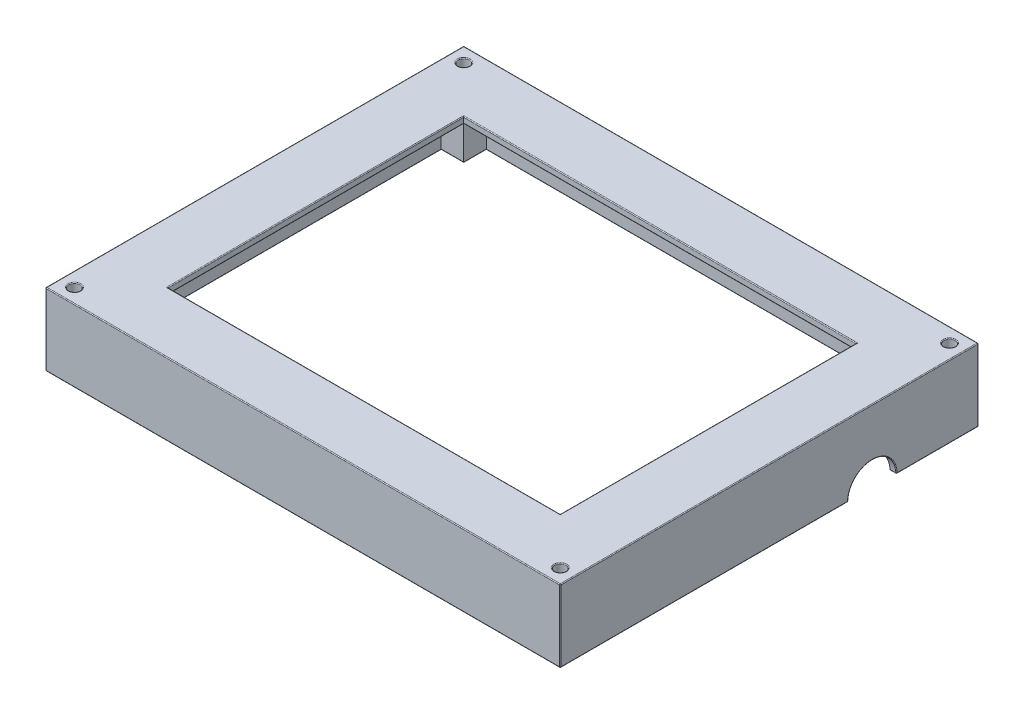
from build123d import *

# Parameters (mm, degrees)
SKETCH1_W           = 160
SKETCH1_H           = 130
SKETCH1_W_2         = 122
SKETCH1_H_2         = 92
BOSS_EXTRUDE1_DEPTH = 2
SKETCH1_3_W         = 2
SKETCH1_3_H         = 112
SKETCH1_3_W_2       = 142
SKETCH1_3_H_2       = 2
BOSS_EXTRUDE3_DEPTH = 22.5
SKETCH1_5_R         = 1.75
BOSS_EXTRUDE5_DEPTH = 14.5
SKETCH3_R           = 7.5
CUT_EXTRUDE1_DEPTH  = 4.5
FILLET1_R           = 0.25


with BuildPart() as part:
    # Sketch1 → Boss-Extrude1 (new body)
    with BuildSketch(Plane(origin=(0, 0, 0), x_dir=(1, 0, 0), z_dir=(0, 1, 0))):
        with Locations((80, 65)):
            Rectangle(SKETCH1_W, SKETCH1_H)
        with Locations((80, 65)):
            Rectangle(SKETCH1_W_2, SKETCH1_H_2, mode=Mode.SUBTRACT)
        Polygon((7.125, 123.984455543), (7.125, 127.015544457), (4.5, 128.531088913), (1.875, 127.015544457), (1.875, 123.984455543), (4.5, 122.468911087), align=None, mode=Mode.SUBTRACT)
        Polygon((158.125, 123.984455543), (158.125, 127.015544457), (155.5, 128.531088913), (152.875, 127.015544457), (152.875, 123.984455543), (155.5, 122.468911087), align=None, mode=Mode.SUBTRACT)
        Polygon((158.125, 2.984455543), (158.125, 6.015544457), (155.5, 7.531088913), (152.875, 6.015544457), (152.875, 2.984455543), (155.5, 1.468911087), align=None, mode=Mode.SUBTRACT)
        Polygon((7.125, 2.984455543), (7.125, 6.015544457), (4.5, 7.531088913), (1.875, 6.015544457), (1.875, 2.984455543), (4.5, 1.468911087), align=None, mode=Mode.SUBTRACT)
    extrude(amount=-BOSS_EXTRUDE1_DEPTH)

    # Sketch1<3> → Boss-Extrude3 (add)
    # profile 1 of 8: a face of its own
    with BuildSketch(Plane(origin=(0, 0, 0), x_dir=(1, 0, 0), z_dir=(0, 1, 0))):
        with Locations((159, 65)):
            Rectangle(SKETCH1_3_W, SKETCH1_3_H)
    # profile 2 of 8: a face of its own
    with BuildSketch(Plane(origin=(0, 0, 0), x_dir=(1, 0, 0), z_dir=(0, 1, 0))):
        Polygon((160, 130), (151, 130), (151, 128), (151, 121), (158, 121), (160, 121), align=None)
        Polygon((158.125, 127.015544457), (158.125, 123.984455543), (155.5, 122.468911087), (152.875, 123.984455543), (152.875, 127.015544457), (155.5, 128.531088913), align=None, mode=Mode.SUBTRACT)
    # profile 3 of 8: a face of its own
    with BuildSketch(Plane(origin=(0, 0, 0), x_dir=(1, 0, 0), z_dir=(0, 1, 0))):
        with Locations((80, 129)):
            Rectangle(SKETCH1_3_W_2, SKETCH1_3_H_2)
    # profile 4 of 8: a face of its own
    with BuildSketch(Plane(origin=(0, 0, 0), x_dir=(1, 0, 0), z_dir=(0, 1, 0))):
        Polygon((0, 130), (0, 121), (2, 121), (9, 121), (9, 128), (9, 130), align=None)
        Polygon((7.125, 127.015544457), (7.125, 123.984455543), (4.5, 122.468911087), (1.875, 123.984455543), (1.875, 127.015544457), (4.5, 128.531088913), align=None, mode=Mode.SUBTRACT)
    # profile 5 of 8: a face of its own
    with BuildSketch(Plane(origin=(0, 0, 0), x_dir=(1, 0, 0), z_dir=(0, 1, 0))):
        with Locations((1, 65)):
            Rectangle(SKETCH1_3_W, SKETCH1_3_H)
    # profile 6 of 8: a face of its own
    with BuildSketch(Plane(origin=(0, 0, 0), x_dir=(1, 0, 0), z_dir=(0, 1, 0))):
        Polygon((151, 2), (151, 0), (160, 0), (160, 9), (158, 9), (151, 9), align=None)
        Polygon((158.125, 6.015544457), (158.125, 2.984455543), (155.5, 1.468911087), (152.875, 2.984455543), (152.875, 6.015544457), (155.5, 7.531088913), align=None, mode=Mode.SUBTRACT)
    # profile 7 of 8: a face of its own
    with BuildSketch(Plane(origin=(0, 0, 0), x_dir=(1, 0, 0), z_dir=(0, 1, 0))):
        with Locations((80, 1)):
            Rectangle(SKETCH1_3_W_2, SKETCH1_3_H_2)
    # profile 8 of 8: a face of its own
    with BuildSketch(Plane(origin=(0, 0, 0), x_dir=(1, 0, 0), z_dir=(0, 1, 0))):
        Polygon((2, 9), (0, 9), (0, 0), (9, 0), (9, 2), (9, 9), align=None)
        Polygon((7.125, 6.015544457), (7.125, 2.984455543), (4.5, 1.468911087), (1.875, 2.984455543), (1.875, 6.015544457), (4.5, 7.531088913), align=None, mode=Mode.SUBTRACT)
    extrude(amount=-BOSS_EXTRUDE3_DEPTH)

    # Sketch1<5> → Boss-Extrude5 (add)
    # profile 1 of 4: a face of its own
    with BuildSketch(Plane(origin=(0, 0, 0), x_dir=(1, 0, 0), z_dir=(0, 1, 0))):
        Polygon((1.875, 123.984455543), (4.5, 122.468911087), (7.125, 123.984455543), (7.125, 127.015544457), (4.5, 128.531088913), (1.875, 127.015544457), align=None)
        with Locations(Location((4.5, 125.5, 0), (0, 0, 270))):
            Circle(SKETCH1_5_R, mode=Mode.SUBTRACT)
    # profile 2 of 4: a face of its own
    with BuildSketch(Plane(origin=(0, 0, 0), x_dir=(1, 0, 0), z_dir=(0, 1, 0))):
        Polygon((1.875, 2.984455543), (4.5, 1.468911087), (7.125, 2.984455543), (7.125, 6.015544457), (4.5, 7.531088913), (1.875, 6.015544457), align=None)
        with Locations(Location((4.5, 4.5, 0), (0, 0, 270))):
            Circle(SKETCH1_5_R, mode=Mode.SUBTRACT)
    # profile 3 of 4: a face of its own
    with BuildSketch(Plane(origin=(0, 0, 0), x_dir=(1, 0, 0), z_dir=(0, 1, 0))):
        Polygon((152.875, 2.984455543), (155.5, 1.468911087), (158.125, 2.984455543), (158.125, 6.015544457), (155.5, 7.531088913), (152.875, 6.015544457), align=None)
        with Locations(Location((155.5, 4.5, 0), (0, 0, 270))):
            Circle(SKETCH1_5_R, mode=Mode.SUBTRACT)
    # profile 4 of 4: a face of its own
    with BuildSketch(Plane(origin=(0, 0, 0), x_dir=(1, 0, 0), z_dir=(0, 1, 0))):
        Polygon((152.875, 123.984455543), (155.5, 122.468911087), (158.125, 123.984455543), (158.125, 127.015544457), (155.5, 128.531088913), (152.875, 127.015544457), align=None)
        with Locations(Location((155.5, 125.5, 0), (0, 0, 270))):
            Circle(SKETCH1_5_R, mode=Mode.SUBTRACT)
    extrude(amount=-BOSS_EXTRUDE5_DEPTH)

    # Sketch3 → Cut-Extrude1 (cut)
    with BuildSketch(Plane(origin=(160, 0, 0), x_dir=(0, 0, -1), z_dir=(1, 0, 0))):
        with Locations((97, -22.5)):
            Circle(SKETCH3_R)
    extrude(amount=-CUT_EXTRUDE1_DEPTH, mode=Mode.SUBTRACT)

    # Fillet1
    fillet1_edges = [part.edges().sort_by_distance(p)[0] for p in [
        (0, -22.5, -65),
        (80, -22.5, 0),
        (2, -2, -65),
        (5.5, -2, -9),
        (9, -2, -5.5),
        (80, -2, -2),
        (151, -2, -5.5),
        (154.5, -2, -9),
        (158, -2, -65),
        (154.5, -2, -121),
        (151, -2, -124.5),
        (80, -2, -128),
        (9, -22.5, -124.5),
        (5.5, -22.5, -121),
        (9, -2, -124.5),
        (5.5, -2, -121),
        (2, -22.5, -65),
        (5.5, -22.5, -9),
        (9, -22.5, -5.5),
        (80, -22.5, -2),
        (151, -22.5, -5.5),
        (154.5, -22.5, -9),
        (158, -22.5, -49.25),
        (154.5, -22.5, -121),
        (151, -22.5, -124.5),
        (80, -22.5, -128),
        (160, -22.5, -117.25),
        (80, -22.5, -130),
        (156.8125, -22.5, -2.226683315),
        (158.125, -22.5, -4.5),
        (156.8125, -22.5, -6.773316685),
        (154.1875, -22.5, -6.773316685),
        (152.875, -22.5, -4.5),
        (154.1875, -22.5, -2.226683315),
        (156.8125, -22.5, -123.226683315),
        (158.125, -22.5, -125.5),
        (156.8125, -22.5, -127.773316685),
        (154.1875, -22.5, -127.773316685),
        (152.875, -22.5, -125.5),
        (154.1875, -22.5, -123.226683315),
        (5.8125, -22.5, -2.226683315),
        (7.125, -22.5, -4.5),
        (5.8125, -22.5, -6.773316685),
        (3.1875, -22.5, -6.773316685),
        (1.875, -22.5, -4.5),
        (3.1875, -22.5, -2.226683315),
        (5.8125, -22.5, -123.226683315),
        (7.125, -22.5, -125.5),
        (5.8125, -22.5, -127.773316685),
        (3.1875, -22.5, -127.773316685),
        (1.875, -22.5, -125.5),
        (3.1875, -22.5, -123.226683315),
        (155.5, 0, -127.25),
        (155.5, 0, -6.25),
        (4.5, 0, -6.25),
        (4.5, 0, -127.25),
        (158, -22.5, -112.75),
        (160, -22.5, -44.75),
        (159, -22.5, -104.5),
        (159, -22.5, -89.5),
        (160, -15, -97),
        (80, 0, -19),
        (141, 0, -65),
        (80, 0, -111),
        (19, 0, -65),
        (80, 0, -130),
        (160, 0, -65),
        (80, 0, 0),
        (0, 0, -65),
        (0, -11.25, -130),
        (160, -11.25, -130),
        (160, -11.25, 0),
        (0, -11.25, 0),
        (19, -2, -65),
        (80, -2, -111),
        (141, -2, -65),
        (80, -2, -19),
    ]]
    fillet(fillet1_edges, radius=FILLET1_R)


solid = part.part
